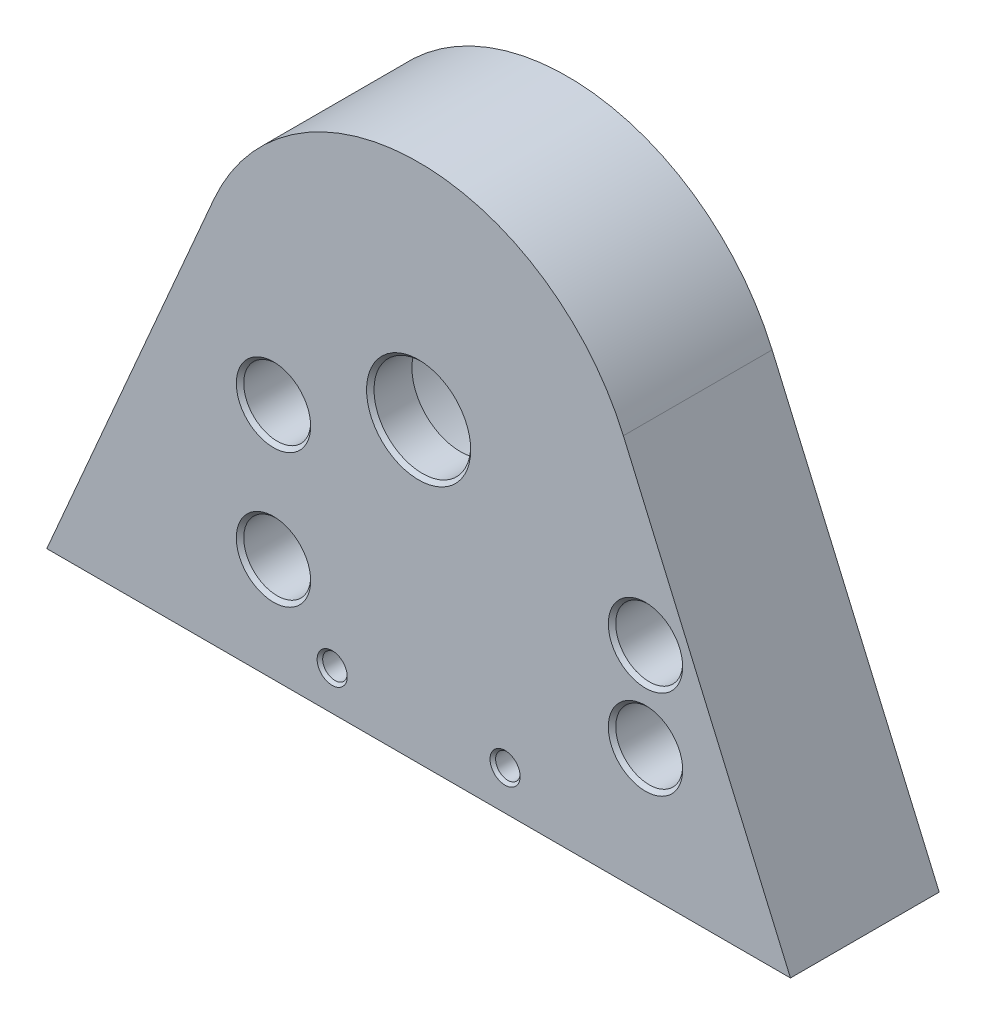
from build123d import *

# Parameters (mm, degrees)
SKIZZE1_R                       = 6.5
AUFSATZ_LINEAR_AUSTRAGEN1_DEPTH = 20
SKIZZE4_R                       = 15
SCHNITT_LINEAR_AUSTRAGEN2_DEPTH = 14.4
M4_GEWINDEBOHRUNG1_D            = 3.3
M4_GEWINDEBOHRUNG1_DEPTH        = 11.5
M4_GEWINDEBOHRUNG1_CSINK_D      = 4.05
M4_GEWINDEBOHRUNG1_CSINK_ANGLE  = 90
M4_GEWINDEBOHRUNG1_TIP          = 0.991420021
SKIZZE7_R                       = 2.25
SCHNITT_LINEAR_AUSTRAGEN3_DEPTH = 20
SKIZZE8_R                       = 4.5
SCHNITT_LINEAR_AUSTRAGEN4_DEPTH = 10
FASE1_SIZE                      = 0.5
FASE2_SIZE                      = 0.5
SKIZZE9_R                       = 1.6
SCHNITT_LINEAR_AUSTRAGEN5_DEPTH = 15
M4_GEWINDEBOHRUNG2_D            = 3.3
M4_GEWINDEBOHRUNG2_DEPTH        = 11.5
M4_GEWINDEBOHRUNG2_CSINK_D      = 4.05
M4_GEWINDEBOHRUNG2_CSINK_ANGLE  = 90
M4_GEWINDEBOHRUNG2_TIP          = 0.991420021
SKIZZE11_R                      = 2.25
SCHNITT_LINEAR_AUSTRAGEN6_DEPTH = 30
SKIZZE12_R                      = 4.5
SCHNITT_LINEAR_AUSTRAGEN7_DEPTH = 10
FASE3_SIZE                      = 0.5


with BuildPart() as part:
    # Skizze1 → Aufsatz-Linear austragen1 (new body)
    with BuildSketch(Plane.XY):
        with BuildLine():
            Line((0, 0), (100, 0))
            Line((100, 0), (77.53225634, 51.915320425))
            ThreePointArc((77.53225634, 51.915320425), (50, 70), (22.46774366, 51.915320425))
            Line((22.46774366, 51.915320425), (0, 0))
        make_face()
        with Locations((50, 40)):
            Circle(SKIZZE1_R, mode=Mode.SUBTRACT)
    extrude(amount=AUFSATZ_LINEAR_AUSTRAGEN1_DEPTH)

    # Skizze4 → Schnitt-Linear austragen2 (cut)
    with BuildSketch(Plane(origin=(0, 0, 0), x_dir=(-1, 0, 0), z_dir=(0, 0, -1))):
        with Locations((-50, 40)):
            Circle(SKIZZE4_R)
    extrude(amount=-SCHNITT_LINEAR_AUSTRAGEN2_DEPTH, mode=Mode.SUBTRACT)

    # M4 Gewindebohrung1
    with Locations(Plane(origin=(38.375, 5.29, 20), x_dir=(1, 0, 0), z_dir=(0, 0, 1))):
        with Locations((0, 0), (23.25, 0)):
            CounterSinkHole(M4_GEWINDEBOHRUNG1_D / 2, M4_GEWINDEBOHRUNG1_CSINK_D / 2, depth=M4_GEWINDEBOHRUNG1_DEPTH, counter_sink_angle=M4_GEWINDEBOHRUNG1_CSINK_ANGLE)
            with Locations((0, 0, -(M4_GEWINDEBOHRUNG1_DEPTH + M4_GEWINDEBOHRUNG1_TIP / 2))):  # 118° drill point
                Cone(0, M4_GEWINDEBOHRUNG1_D / 2, M4_GEWINDEBOHRUNG1_TIP, mode=Mode.SUBTRACT)

    # Skizze7 → Schnitt-Linear austragen3 (cut)
    with BuildSketch(Plane(origin=(0, 0, 0), x_dir=(-1, 0, 0), z_dir=(0, 0, -1))):
        with Locations((-30.48202317, 32)):
            Circle(SKIZZE7_R)
        with Locations((-30.48202317, 14)):
            Circle(SKIZZE7_R)
    extrude(amount=-SCHNITT_LINEAR_AUSTRAGEN3_DEPTH, mode=Mode.SUBTRACT)

    # Skizze8 → Schnitt-Linear austragen4 (cut)
    with BuildSketch(Plane.XY.offset(20)):
        with Locations((30.48202317, 32)):
            Circle(SKIZZE8_R)
        with Locations((30.48202317, 14)):
            Circle(SKIZZE8_R)
    extrude(amount=-SCHNITT_LINEAR_AUSTRAGEN4_DEPTH, mode=Mode.SUBTRACT)

    # Fase1
    fase1_edges = [part.edges().sort_by_distance(p)[0] for p in [
        (43.5, 40, 20),
        (25.98202317, 32, 20),
        (25.98202317, 14, 20),
    ]]
    chamfer(fase1_edges, length=FASE1_SIZE)

    # Fase2
    fase2_edges = [part.edges().sort_by_distance(p)[0] for p in [
        (65, 40, 0),
        (32.73202317, 32, 0),
        (32.73202317, 14, 0),
    ]]
    chamfer(fase2_edges, length=FASE2_SIZE)

    # Skizze9 → Schnitt-Linear austragen5 (cut)
    with BuildSketch(Plane(origin=(0, 0, 0), x_dir=(-1, 0, 0), z_dir=(0, 0, -1))):
        with Locations((-50, 60)):
            Circle(SKIZZE9_R)
        with Locations((-70, 40)):
            Circle(SKIZZE9_R)
        with Locations((-50, 20)):
            Circle(SKIZZE9_R)
    extrude(amount=-SCHNITT_LINEAR_AUSTRAGEN5_DEPTH, mode=Mode.SUBTRACT)

    # M4 Gewindebohrung2
    with Locations(Plane(origin=(70, 40, 0), x_dir=(-1, 0, 0), z_dir=(0, 0, -1))):
        with Locations((0, 0), (20, 20), (20, -20)):
            CounterSinkHole(M4_GEWINDEBOHRUNG2_D / 2, M4_GEWINDEBOHRUNG2_CSINK_D / 2, depth=M4_GEWINDEBOHRUNG2_DEPTH, counter_sink_angle=M4_GEWINDEBOHRUNG2_CSINK_ANGLE)
            with Locations((0, 0, -(M4_GEWINDEBOHRUNG2_DEPTH + M4_GEWINDEBOHRUNG2_TIP / 2))):  # 118° drill point
                Cone(0, M4_GEWINDEBOHRUNG2_D / 2, M4_GEWINDEBOHRUNG2_TIP, mode=Mode.SUBTRACT)

    # Skizze11 → Schnitt-Linear austragen6 (cut)
    with BuildSketch(Plane(origin=(0, 0, 0), x_dir=(-1, 0, 0), z_dir=(0, 0, -1))):
        with Locations((-80.50404106, 29)):
            Circle(SKIZZE11_R)
        with Locations((-80.50404106, 17)):
            Circle(SKIZZE11_R)
    extrude(amount=-SCHNITT_LINEAR_AUSTRAGEN6_DEPTH, mode=Mode.SUBTRACT)

    # Skizze12 → Schnitt-Linear austragen7 (cut)
    with BuildSketch(Plane.XY.offset(20)):
        with Locations((80.50404106, 29)):
            Circle(SKIZZE12_R)
        with Locations((80.50404106, 17)):
            Circle(SKIZZE12_R)
    extrude(amount=-SCHNITT_LINEAR_AUSTRAGEN7_DEPTH, mode=Mode.SUBTRACT)

    # Fase3
    fase3_edges = [part.edges().sort_by_distance(p)[0] for p in [
        (76.00404106, 29, 20),
        (76.00404106, 17, 20),
    ]]
    chamfer(fase3_edges, length=FASE3_SIZE)


solid = part.part
